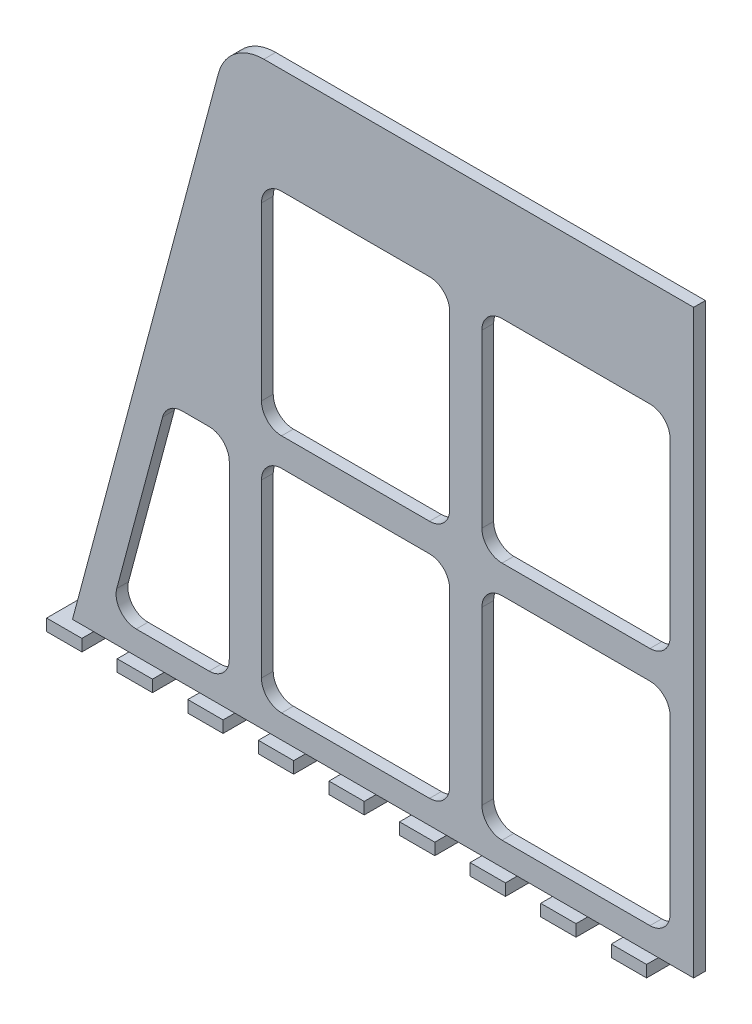
from build123d import *

# Parameters (mm, degrees)
BOSS_EXTRUDE1_DEPTH      = 6.35
CUT_EXTRUDE1_DEPTH       = 6.35
BOSS_EXTRUDE2_DEPTH      = 6.35
BOSS_EXTRUDE2_DEPTH_BACK = 12.7
SKETCH3_W                = 19.05
SKETCH3_H                = 6.35


with BuildPart() as part:
    # Sketch1 → Boss-Extrude1 (new body)
    with BuildSketch(Plane.XY):
        with BuildLine():
            Line((0, 0), (335.28, 0))
            Line((335.28, 0), (335.28, 313.51728))
            Line((335.28, 313.51728), (103.321320582, 313.51728))
            ThreePointArc((103.321320582, 313.51728), (87.853181888, 308.264157806), (78.783155215, 294.677648925))
            Line((78.783155215, 294.677648925), (0, 0))
        make_face()
    extrude(amount=BOSS_EXTRUDE1_DEPTH)

    # Sketch2 → Cut-Extrude1 (cut)
    with BuildSketch(Plane.XY.offset(6.35)):
        with BuildLine():
            Line((311.705446202, 12.7), (231.854553798, 12.7))
            ThreePointArc((231.854553798, 12.7), (224.165083065, 15.885083065), (220.98, 23.574553798))
            Line((220.98, 23.574553798), (220.98, 116.125446202))
            ThreePointArc((220.98, 116.125446202), (224.165083065, 123.814916935), (231.854553798, 127))
            Line((231.854553798, 127), (311.705446202, 127))
            ThreePointArc((311.705446202, 127), (319.394916935, 123.814916935), (322.58, 116.125446202))
            Line((322.58, 116.125446202), (322.58, 23.574553798))
            ThreePointArc((322.58, 23.574553798), (319.394916935, 15.885083065), (311.705446202, 12.7))
        make_face()
        with BuildLine():
            Line((203.603317785, 23.574553798), (203.603317785, 116.125446202))
            ThreePointArc((203.603317785, 116.125446202), (200.41823472, 123.814916935), (192.728763987, 127))
            Line((192.728763987, 127), (112.877871584, 127))
            ThreePointArc((112.877871584, 127), (105.18840085, 123.814916935), (102.003317785, 116.125446202))
            Line((102.003317785, 116.125446202), (102.003317785, 23.574553798))
            ThreePointArc((102.003317785, 23.574553798), (105.18840085, 15.885083065), (112.877871584, 12.7))
            Line((112.877871584, 12.7), (192.728763987, 12.7))
            ThreePointArc((192.728763987, 12.7), (200.41823472, 15.885083065), (203.603317785, 23.574553798))
        make_face()
        with BuildLine():
            Line((84.62663557, 23.574553798), (84.62663557, 116.125446202))
            ThreePointArc((84.62663557, 116.125446202), (81.441552505, 123.814916935), (73.752081772, 127))
            Line((73.752081772, 127), (59.157987156, 127))
            ThreePointArc((59.157987156, 127), (52.535581392, 124.750970083), (48.652412376, 118.934150328))
            Line((48.652412376, 118.934150328), (23.908590277, 26.383257925))
            ThreePointArc((23.908590277, 26.383257925), (25.788641176, 16.952148035), (34.414165057, 12.7))
            Line((34.414165057, 12.7), (73.752081772, 12.7))
            ThreePointArc((73.752081772, 12.7), (81.441552505, 15.885083065), (84.62663557, 23.574553798))
        make_face()
        with BuildLine():
            Line((203.603317785, 153.114553798), (203.603317785, 245.665446202))
            ThreePointArc((203.603317785, 245.665446202), (200.41823472, 253.354916935), (192.728763987, 256.54))
            Line((192.728763987, 256.54), (112.877871584, 256.54))
            ThreePointArc((112.877871584, 256.54), (105.18840085, 253.354916935), (102.003317785, 245.665446202))
            Line((102.003317785, 245.665446202), (102.003317785, 153.114553798))
            ThreePointArc((102.003317785, 153.114553798), (105.18840085, 145.425083065), (112.877871584, 142.24))
            Line((112.877871584, 142.24), (192.728763987, 142.24))
            ThreePointArc((192.728763987, 142.24), (200.41823472, 145.425083065), (203.603317785, 153.114553798))
        make_face()
        with BuildLine():
            Line((322.58, 153.114553798), (322.58, 245.665446202))
            ThreePointArc((322.58, 245.665446202), (319.394916935, 253.354916935), (311.705446202, 256.54))
            Line((311.705446202, 256.54), (231.854553798, 256.54))
            ThreePointArc((231.854553798, 256.54), (224.165083065, 253.354916935), (220.98, 245.665446202))
            Line((220.98, 245.665446202), (220.98, 153.114553798))
            ThreePointArc((220.98, 153.114553798), (224.165083065, 145.425083065), (231.854553798, 142.24))
            Line((231.854553798, 142.24), (311.705446202, 142.24))
            ThreePointArc((311.705446202, 142.24), (319.394916935, 145.425083065), (322.58, 153.114553798))
        make_face()
    extrude(amount=-CUT_EXTRUDE1_DEPTH, mode=Mode.SUBTRACT)

    # Sketch3 → Boss-Extrude2 (add, two sides: drawn at the far end of the back side and taken through both)
    with BuildSketch(Plane.XY.offset(6.35).offset(-BOSS_EXTRUDE2_DEPTH_BACK)):
        Polygon((11.43, -6.35), (11.43, 0), (0, 0), (-7.62, 0), (-7.62, -6.35), align=None)
        with Locations((40.005, -3.175)):
            Rectangle(SKETCH3_W, SKETCH3_H)
        with Locations((78.105, -3.175)):
            Rectangle(SKETCH3_W, SKETCH3_H)
        with Locations((116.205, -3.175)):
            Rectangle(SKETCH3_W, SKETCH3_H)
        with Locations((154.305, -3.175)):
            Rectangle(SKETCH3_W, SKETCH3_H)
        with Locations((192.405, -3.175)):
            Rectangle(SKETCH3_W, SKETCH3_H)
        with Locations((230.505, -3.175)):
            Rectangle(SKETCH3_W, SKETCH3_H)
        with Locations((268.605, -3.175)):
            Rectangle(SKETCH3_W, SKETCH3_H)
        with Locations((306.705, -3.175)):
            Rectangle(SKETCH3_W, SKETCH3_H)
    extrude(amount=BOSS_EXTRUDE2_DEPTH + BOSS_EXTRUDE2_DEPTH_BACK)


solid = part.part
